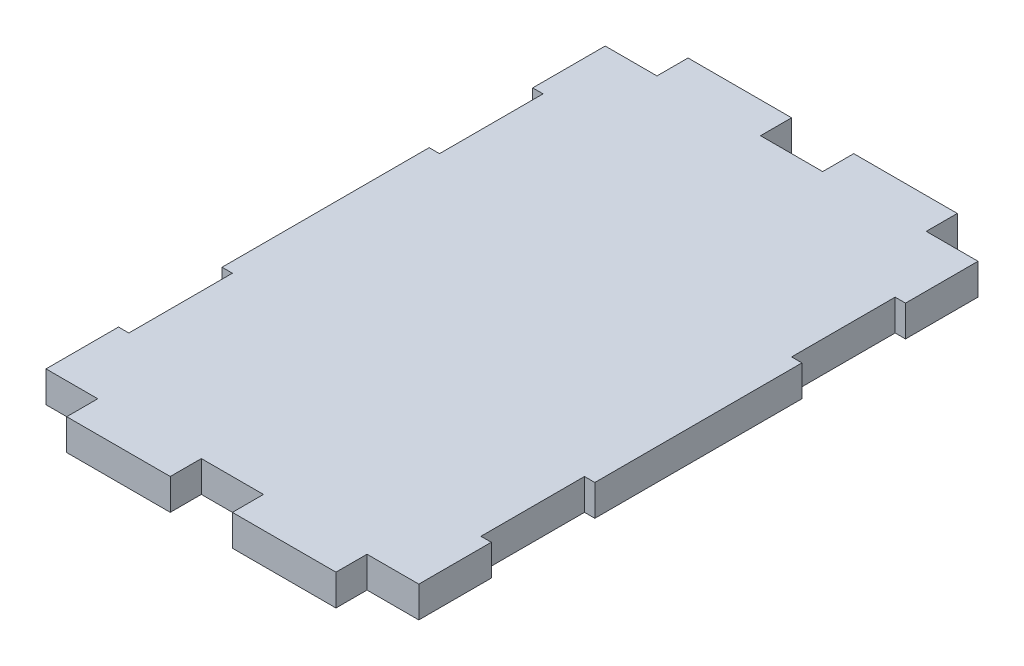
from build123d import *

# Parameters (mm, degrees)
SKETCH1_W           = 34
SKETCH1_H           = 54
SKETCH1_W_2         = 10
SKETCH1_H_2         = 3
SKETCH1_W_3         = 1
SKETCH1_H_3         = 7
SKETCH1_H_4         = 20
BOSS_EXTRUDE1_DEPTH = 3


with BuildPart() as part:
    # Sketch1 → Boss-Extrude1 (new body)
    with BuildSketch(Plane(origin=(0, 0, 0), x_dir=(1, 0, 0), z_dir=(0, 1, 0))):
        with Locations((18, 30)):
            Rectangle(SKETCH1_W, SKETCH1_H)
        with Locations((10, 1.5)):
            Rectangle(SKETCH1_W_2, SKETCH1_H_2)
        with Locations((26, 1.5)):
            Rectangle(SKETCH1_W_2, SKETCH1_H_2)
        with Locations((35.5, 6.5)):
            Rectangle(SKETCH1_W_3, SKETCH1_H_3)
        with Locations((35.5, 30)):
            Rectangle(SKETCH1_W_3, SKETCH1_H_4)
        with Locations((35.5, 53.5)):
            Rectangle(SKETCH1_W_3, SKETCH1_H_3)
        with Locations((26, 58.5)):
            Rectangle(SKETCH1_W_2, SKETCH1_H_2)
        with Locations((10, 58.5)):
            Rectangle(SKETCH1_W_2, SKETCH1_H_2)
        with Locations((0.5, 53.5)):
            Rectangle(SKETCH1_W_3, SKETCH1_H_3)
        with Locations((0.5, 30)):
            Rectangle(SKETCH1_W_3, SKETCH1_H_4)
        with Locations((0.5, 6.5)):
            Rectangle(SKETCH1_W_3, SKETCH1_H_3)
    extrude(amount=BOSS_EXTRUDE1_DEPTH)


solid = part.part
